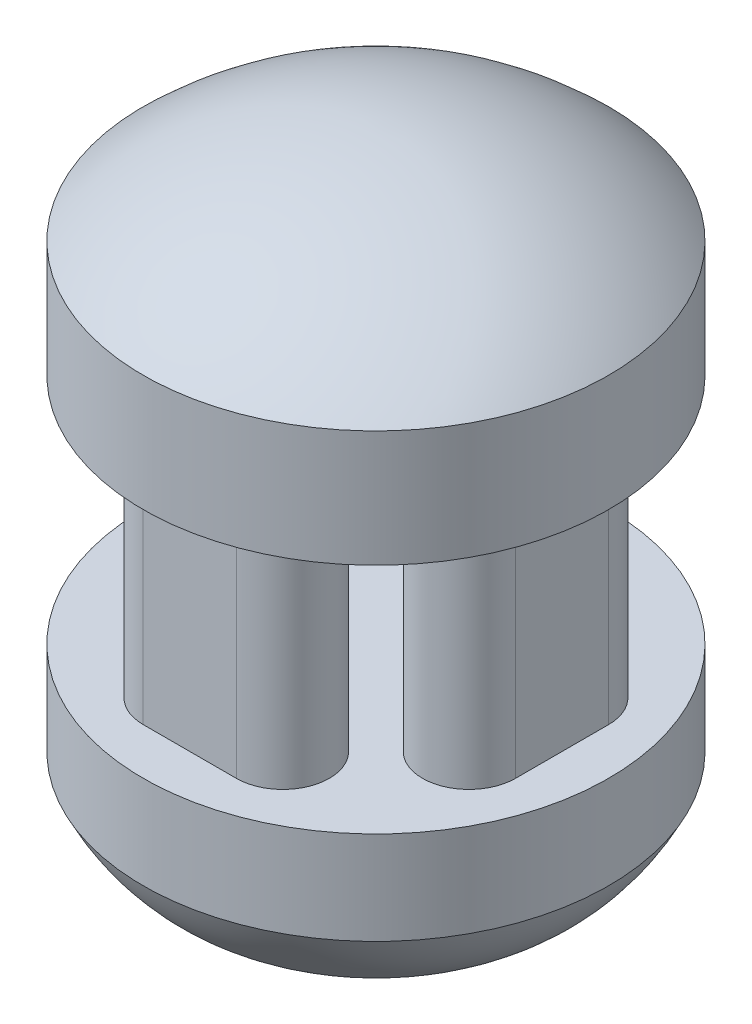
from build123d import *

# Parameters (mm, degrees)
SKETCH1_W             = 6.35
SKETCH1_H             = 3.175
DOMEY_TOP_FACE_RADIUS = 6.35
DOMEY_TOP_HEIGHT      = 2.54
ONE_LEG_DEPTH         = 6.35
ALL_LEGS_COUNT        = 4
BASE_START            = 2.54
SKETCH3_R             = 6.35
BASE_DEPTH            = 2.54


with BuildPart() as part:
    # Sketch1 → button top (revolve)
    with BuildSketch(Plane.XY, mode=Mode.PRIVATE) as button_top_sk:
        with Locations((-3.175, 1.5875)):
            Rectangle(SKETCH1_W, SKETCH1_H)
    revolve(button_top_sk.sketch.rotate(Axis((0, 0, 0), (0, 1, 0)), 270), axis=Axis((0, 0, 0), (0, 1, 0)))

    # domey top: a dome of height H over a round flat face of radius A is a cap of a sphere of radius (A * A + H * H) / (2 * H)
    domey_top_r = (DOMEY_TOP_FACE_RADIUS * DOMEY_TOP_FACE_RADIUS + DOMEY_TOP_HEIGHT * DOMEY_TOP_HEIGHT) / (2 * DOMEY_TOP_HEIGHT)
    domey_top_base = Plane((0, 3.175, 0), z_dir=(0, 1, 0))
    with Locations(domey_top_base.offset(DOMEY_TOP_HEIGHT - domey_top_r)):
        domey_top_ball = Sphere(domey_top_r, mode=Mode.PRIVATE)
    add(split(domey_top_ball, bisect_by=domey_top_base, keep=Keep.TOP, mode=Mode.PRIVATE))

    # Sketch2 → one leg (add)
    with BuildSketch(Plane.XZ):
        with BuildLine():
            Line((-1.27, -2.54), (1.27, -2.54))
            ThreePointArc((1.27, -2.54), (2.54, -3.81), (1.27, -5.08))
            Line((1.27, -5.08), (-1.27, -5.08))
            ThreePointArc((-1.27, -5.08), (-2.54, -3.81), (-1.27, -2.54))
        make_face()
    one_leg = extrude(amount=ONE_LEG_DEPTH)

    # all legs: one leg ×4 about axis
    all_legs_axis = Axis((0, 0, 0), (0, 1, 0))
    for i in range(1, ALL_LEGS_COUNT):
        add(one_leg.rotate(all_legs_axis, i * 360 / ALL_LEGS_COUNT))

    # Sketch3 → base (add)
    with BuildSketch(Plane.XZ.offset(6.35).offset(BASE_START)):
        with Locations(Location((0, 0, 0), (0, 0, 270))):
            Circle(SKETCH3_R)
    extrude(amount=-BASE_DEPTH)

    # Sketch6 → Revolve2 (revolve)
    with BuildSketch(Plane(origin=(0, 0, 0), x_dir=(0, 0, -1), z_dir=(1, 0, 0))):
        with BuildLine():
            Line((0, -8.89), (0, -11.938))
            add(Edge.make_bspline(
                [(0, -11.938), (2.963289741, -11.938), (5.038193669, -11.554158935), (6.35, -8.89)],
                knots=[0, 0, 0, 0, 1, 1, 1, 1], degree=3))
            Line((6.35, -8.89), (0, -8.89))
        make_face()
    revolve(axis=Axis((0, -8.89, 0), (0, -1, 0)))


solid = part.part
